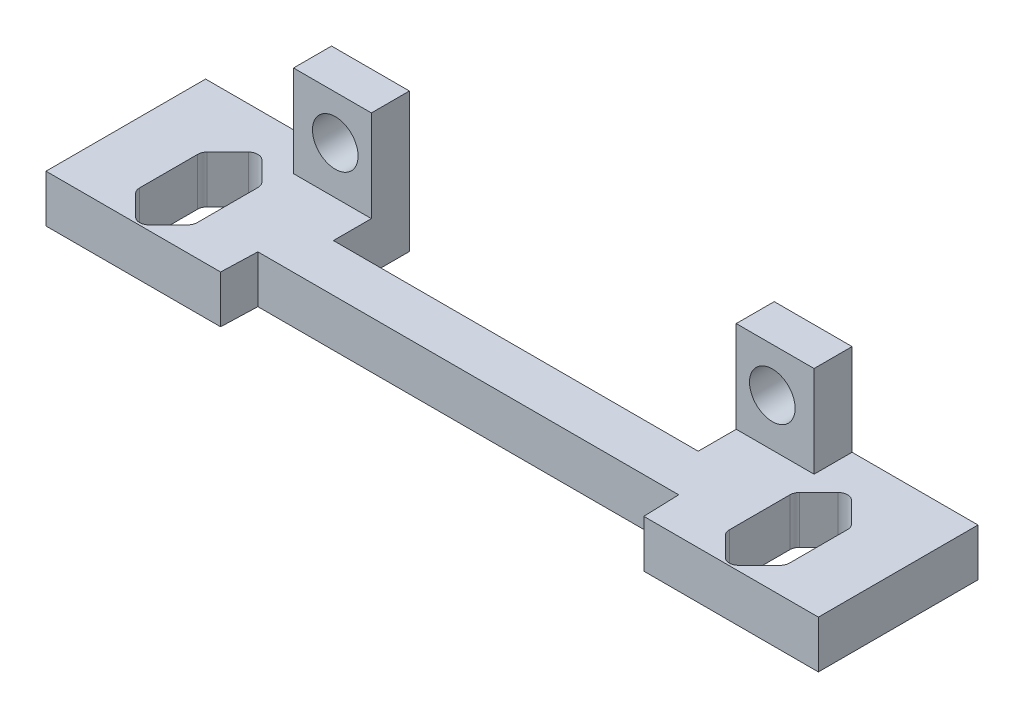
from build123d import *

# Parameters (mm, degrees)
EXTRUDE_1728_DEPTH   = 2.5
EXTRUDE_1728_2_DEPTH = 2.5
SKETCH_3_W           = 4.096784854
SKETCH_3_H           = 4.817676116
SKETCH_3_R           = 1.2
EXTRUDE_1_DEPTH      = 2
EXTRUDE_2_REACH      = 41.086
SKETCH_5_W           = 2.5
SKETCH_5_H           = 2.5


with BuildPart() as part:
    # 草图2 → Extrude 1728 (new body)
    with BuildSketch(Plane(origin=(0, 0, 0), x_dir=(1, 0, 0), z_dir=(0, 1, 0))):
        Polygon((11.136061282, -24.056246494), (20.323880385, -24.056246494), (20.323880385, -15.656749138), (17.100927376, -15.656749138), (14.000927376, -15.656749138), (10.862052049, -15.656749138), (9.6, -15.656749138), (9.6, -22.156749138), (11.073569208, -22.156749138), align=None)
        with BuildLine():
            Line((14.000927376, -19.227513168), (14.000927376, -22.422888537))
            ThreePointArc((14.000927376, -22.422888537), (14.03898761, -22.614230253), (14.147373985, -22.776441927))
            Line((14.147373985, -22.776441927), (15.162186301, -23.791254243))
            ThreePointArc((15.162186301, -23.791254243), (15.515739691, -23.937700852), (15.869293082, -23.791254243))
            Line((15.869293082, -23.791254243), (16.954480766, -22.706066558))
            ThreePointArc((16.954480766, -22.706066558), (17.062867142, -22.543854884), (17.100927376, -22.352513168))
            Line((17.100927376, -22.352513168), (17.100927376, -19.297888537))
            ThreePointArc((17.100927376, -19.297888537), (17.062867142, -19.10654682), (16.954480766, -18.944335146))
            Line((16.954480766, -18.944335146), (15.869293082, -17.859147462))
            ThreePointArc((15.869293082, -17.859147462), (15.515739691, -17.712700852), (15.162186301, -17.859147462))
            Line((15.162186301, -17.859147462), (14.147373985, -18.873959777))
            ThreePointArc((14.147373985, -18.873959777), (14.03898761, -19.036171452), (14.000927376, -19.227513168))
        make_face(mode=Mode.SUBTRACT)
    extrude(amount=EXTRUDE_1728_DEPTH)



with BuildPart() as body_2:
    # 草图2 → Extrude 1728 2 (new body)
    with BuildSketch(Plane(origin=(0, 0, 0), x_dir=(1, 0, 0), z_dir=(0, 1, 0))):
        Polygon((-11.136061282, -24.056246494), (-20.323880385, -24.056246494), (-20.323880385, -15.656749138), (-17.100927376, -15.656749138), (-14.000927376, -15.656749138), (-10.862052049, -15.656749138), (-9.6, -15.656749138), (-9.6, -22.156749138), (-11.073569208, -22.156749138), align=None)
        with BuildLine():
            Line((-14.000927376, -19.227513168), (-14.000927376, -22.422888537))
            ThreePointArc((-14.000927376, -22.422888537), (-14.03898761, -22.614230253), (-14.147373985, -22.776441927))
            Line((-14.147373985, -22.776441927), (-15.162186301, -23.791254243))
            ThreePointArc((-15.162186301, -23.791254243), (-15.515739691, -23.937700852), (-15.869293082, -23.791254243))
            Line((-15.869293082, -23.791254243), (-16.954480766, -22.706066558))
            ThreePointArc((-16.954480766, -22.706066558), (-17.062867142, -22.543854884), (-17.100927376, -22.352513168))
            Line((-17.100927376, -22.352513168), (-17.100927376, -19.297888537))
            ThreePointArc((-17.100927376, -19.297888537), (-17.062867142, -19.10654682), (-16.954480766, -18.944335146))
            Line((-16.954480766, -18.944335146), (-15.869293082, -17.859147462))
            ThreePointArc((-15.869293082, -17.859147462), (-15.515739691, -17.712700852), (-15.162186301, -17.859147462))
            Line((-15.162186301, -17.859147462), (-14.147373985, -18.873959777))
            ThreePointArc((-14.147373985, -18.873959777), (-14.03898761, -19.036171452), (-14.000927376, -19.227513168))
        make_face(mode=Mode.SUBTRACT)
    extrude(amount=EXTRUDE_1728_2_DEPTH)


with BuildPart() as part_1:
    add(part.part)

    add(body_2.part)  # 凸台-拉伸1 merges body 2
    # 草图3 → 凸台-拉伸1 (add)
    # profile 1 of 2: a face of its own
    with BuildSketch(Plane(origin=(0, 0, 15.656749138), x_dir=(-1, 0, 0), z_dir=(0, 0, -1))):
        with Locations((-11.648392427, 4.908838058)):
            Rectangle(SKETCH_3_W, SKETCH_3_H)
        with Locations((-11.5, 5)):
            Circle(SKETCH_3_R, mode=Mode.SUBTRACT)
    # profile 2 of 2: a face of its own
    with BuildSketch(Plane(origin=(0, 0, 15.656749138), x_dir=(-1, 0, 0), z_dir=(0, 0, -1))):
        with Locations((11.648392427, 4.908838058)):
            Rectangle(SKETCH_3_W, SKETCH_3_H)
        with Locations(Location((11.5, 5, 0), (0, 0, 180))):
            Circle(SKETCH_3_R, mode=Mode.SUBTRACT)
    extrude(amount=-EXTRUDE_1_DEPTH)

    # 草图5 → 凸台-拉伸2 (add, up to next)
    with BuildSketch(Plane.ZY.offset(-9.6), mode=Mode.PRIVATE) as extrude_2_sk1:
        with Locations((20.906749138, 1.25)):
            Rectangle(SKETCH_5_W, SKETCH_5_H)
    extrude_2_tool1 = extrude(extrude_2_sk1.sketch, amount=EXTRUDE_2_REACH, mode=Mode.PRIVATE) - part_1.part
    add(extrude_2_tool1.solids().sort_by_distance((9.6, 1.25, 20.906749))[0])


solid = part_1.part
